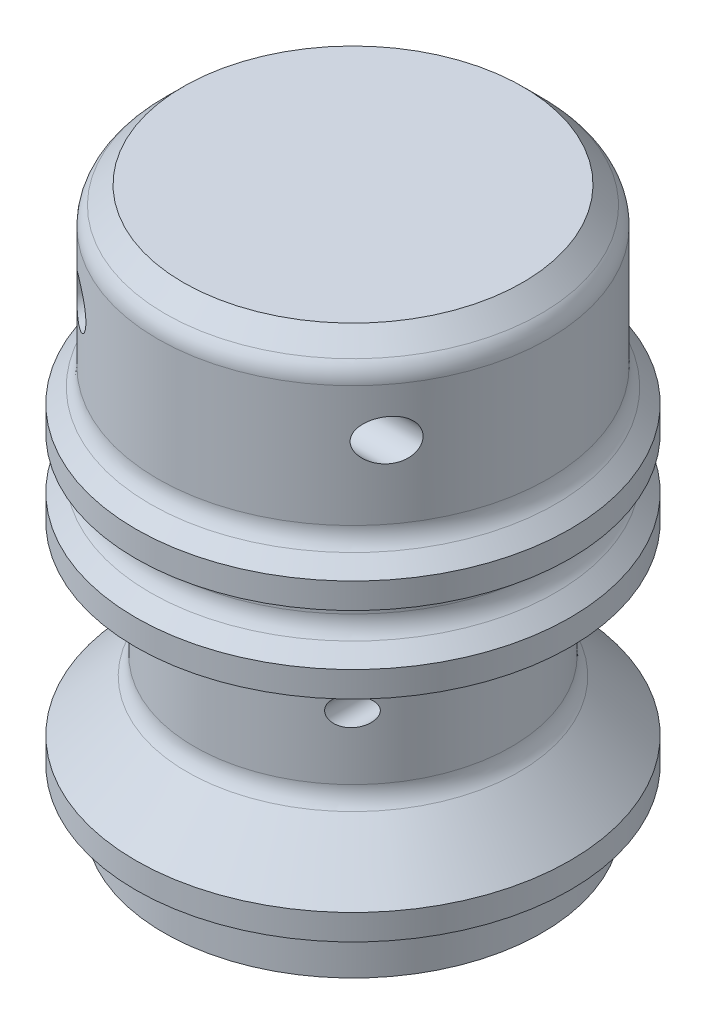
from build123d import *

# Parameters (mm, degrees)
ESBO_O5_R                  = 0.802
INLET_1_DEPTH              = 25.204388291
PADR_OCIRCULAR1_COUNT      = 4
CORTE_EXTRUS_O1_REACH      = 30.96
CORTE_EXTRUS_O1_END_RADIUS = 4.889
ESBO_O9_R                  = 0.546
PADR_OCIRCULAR2_COUNT      = 4
CHANFRO1_SIZE              = 1
FILETE3_R                  = 1
FILETE_TOPO_R              = 0.35
FILETE_BASE_R              = 2
FILETE4_R                  = 1
FILETE5_R                  = 0.5


with BuildPart() as part:
    # Esboço4 → Revolução1 (revolve)
    with BuildSketch(Plane.XY, mode=Mode.PRIVATE) as revolu_o1_sk:
        Polygon((3.105, 1), (3.105, 10.329), (5.46, 12.684), (5.46, 19.658), (0, 19.658), (0, 21.658), (7.641447786, 21.658), (7.641447786, 10.732), (6.204569846, 10.732), (6.204569846, 4), (7.4, 4), (7.4, 0), (5.798, 0), (5.798, 2.899), (4.889, 4.473434184), (4.889, 4.889), (4.889, 9.232), (4.105, 9.232), (4.105, 1), align=None)
    revolve(revolu_o1_sk.sketch.rotate(Axis((0, 0, 0), (0, 1, 0)), 90), axis=Axis((0, 0, 0), (0, 1, 0)))

    # Esboço5 → Inlet_1 (cut, through all)
    with BuildSketch(Plane.XY):
        with Locations((4.658, 18.356)):
            Circle(ESBO_O5_R)
    inlet_1 = extrude(amount=-INLET_1_DEPTH, mode=Mode.SUBTRACT)

    # PadrãoCircular1: Inlet_1 ×4 about axis
    padr_ocircular1_axis = Axis((0, 0, 0), (0, -1, 0))
    for i in range(1, PADR_OCIRCULAR1_COUNT):
        add(inlet_1.rotate(padr_ocircular1_axis, i * 360 / PADR_OCIRCULAR1_COUNT), mode=Mode.SUBTRACT)

    # Corte-extrusão1: up to this cylinder (the profile starts outside it)
    corte_extrus_o1_end = Plane(origin=(0, 8.186, 0), z_dir=(0, -1, 0)) * Cylinder(CORTE_EXTRUS_O1_END_RADIUS, 72.698, mode=Mode.PRIVATE)
    # Esboço9 → Corte-extrusão1 (cut, up to the surface)
    with BuildSketch(Plane.XY.offset(-10), mode=Mode.PRIVATE) as corte_extrus_o1_sk1:
        with Locations(Location((-4.343, 8.186, 0), (0, 0, 180))):
            Circle(ESBO_O9_R)
    corte_extrus_o1_tool1 = extrude(corte_extrus_o1_sk1.sketch, amount=CORTE_EXTRUS_O1_REACH, mode=Mode.PRIVATE) - corte_extrus_o1_end
    corte_extrus_o1 = corte_extrus_o1_tool1.solids().sort_by_distance((-4.343, 8.186, -10))[0]
    add(corte_extrus_o1, mode=Mode.SUBTRACT)

    # PadrãoCircular2: Corte-extrusão1 ×4 about axis
    padr_ocircular2_axis = Axis((0, 0, 0), (0, 1, 0))
    for i in range(1, PADR_OCIRCULAR2_COUNT):
        add(corte_extrus_o1.rotate(padr_ocircular2_axis, i * 360 / PADR_OCIRCULAR2_COUNT), mode=Mode.SUBTRACT)

    # Chanfro1
    chanfro1_edges = [part.edges().sort_by_distance(p)[0] for p in [
        (0, 21.658, 7.641447786),
    ]]
    chamfer(chanfro1_edges, length=CHANFRO1_SIZE)

    # Filete3
    filete3_edges = [part.edges().sort_by_distance(p)[0] for p in [
        (0, 20.658, 7.641447786),
    ]]
    fillet(filete3_edges, radius=FILETE3_R)

    # Filete_topo
    filete_topo_edges = [part.edges().sort_by_distance(p)[0] for p in [
        (0, 9.232, 4.105),
        (0, 9.232, 4.889),
        (0, 19.658, 5.46),
    ]]
    fillet(filete_topo_edges, radius=FILETE_TOPO_R)

    # Filete_base
    filete_base_edges = [part.edges().sort_by_distance(p)[0] for p in [
        (0, 4.473434184, 4.889),
        (0, 2.899, 5.798),
        (0, 12.684, 5.46),
        (0, 10.329, 3.105),
    ]]
    fillet(filete_base_edges, radius=FILETE_BASE_R)

    # Esboço11 → Revolução2 (revolve)
    with BuildSketch(Plane.XY, mode=Mode.PRIVATE) as revolu_o2_sk:
        Polygon((6.204569846, 10.232), (8.5, 10.232), (8.5, 11.232), (7.641447786, 12.090552214), (7.641447786, 13.232), (8.5, 13.232), (8.5, 14.232), (7.641447786, 15.090552214), (7.141447786, 15.090552214), (7.141447786, 11.232), (5.704569846, 11.232), (5.704569846, 10.232), align=None)
        Polygon((7.4, 2), (8.5, 2), (8.5, 3), (6.204569846, 5.295430154), (5.704569846, 5.295430154), (5.704569846, 4), (6.9, 2), align=None)
    revolve(revolu_o2_sk.sketch.rotate(Axis((0, 0, 0), (0, 1, 0)), 90), axis=Axis((0, 0, 0), (0, 1, 0)))

    # Filete4
    filete4_edges = [part.edges().sort_by_distance(p)[0] for p in [
        (0, 15.090552214, 7.641447786),
        (0, 12.090552214, 7.641447786),
        (0, 10.232, 6.204569846),
        (0, 5.295430154, 6.204569846),
    ]]
    fillet(filete4_edges, radius=FILETE4_R)

    # Filete5
    filete5_edges = [part.edges().sort_by_distance(p)[0] for p in [
        (0, 13.232, 7.641447786),
        (0, 2, 7.4),
    ]]
    fillet(filete5_edges, radius=FILETE5_R)


solid = part.part
